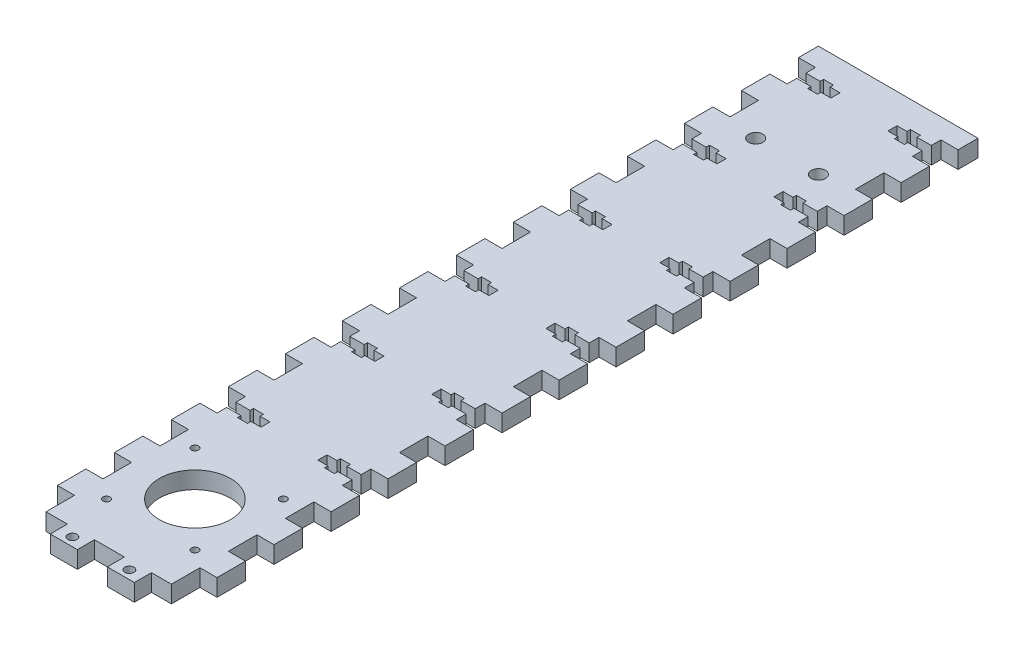
from build123d import *

# Parameters (mm, degrees)
SKETCH1_W               = 56
SKETCH1_H               = 6
BOSS_EXTRUDE1_DEPTH     = 277
SKETCH3_W               = 6
SKETCH3_H               = 10
CUT_EXTRUDE1_DEPTH      = 291.029245391
SKETCH6_W               = 9.5
SKETCH6_H               = 6
BOSS_EXTRUDE2_DEPTH     = 6
SKETCH9_W               = 3.2
SKETCH9_H               = 6
CUT_EXTRUDE2_DEPTH      = 12
SKETCH10_W              = 3.2
SKETCH10_H              = 6
CUT_EXTRUDE3_DEPTH      = 12
SKETCH11_W              = 3.5
SKETCH11_H              = 5.6
CUT_EXTRUDE4_DEPTH      = 12
SKETCH12_R              = 1.6
CUT_EXTRUDE5_DEPTH      = 12
SKETCH17_W              = 44
SKETCH17_H              = 10
BOSS_EXTRUDE5_DEPTH     = 6
CUT_EXTRUDE6_DEPTH      = 296.765047262
CUT_EXTRUDE6_DEPTH_BACK = 296.765047262
SKETCH14_R              = 1.25
SKETCH14_R_2            = 12.5
SKETCH15_R              = 2.5
CUT_EXTRUDE7_DEPTH      = 296.765047262


with BuildPart() as part:
    # Sketch1 → Boss-Extrude1 (new body)
    with BuildSketch(Plane.XY):
        with Locations((-57.743589744, 27.128205128)):
            Rectangle(SKETCH1_W, SKETCH1_H)
    extrude(amount=BOSS_EXTRUDE1_DEPTH)

    # Sketch3 → Cut-Extrude1 (cut, through all)
    with BuildSketch(Plane(origin=(0, 30.128205128, 0), x_dir=(1, 0, 0), z_dir=(0, 1, 0))):
        with Locations((-82.743589744, -272)):
            Rectangle(SKETCH3_W, SKETCH3_H)
        with Locations((-32.743589744, -272)):
            Rectangle(SKETCH3_W, SKETCH3_H)
        with Locations((-82.743589744, -252)):
            Rectangle(SKETCH3_W, SKETCH3_H)
        with Locations((-32.743589744, -252)):
            Rectangle(SKETCH3_W, SKETCH3_H)
        with Locations((-82.743589744, -232)):
            Rectangle(SKETCH3_W, SKETCH3_H)
        with Locations((-32.743589744, -232)):
            Rectangle(SKETCH3_W, SKETCH3_H)
        with Locations((-82.743589744, -212)):
            Rectangle(SKETCH3_W, SKETCH3_H)
        with Locations((-32.743589744, -212)):
            Rectangle(SKETCH3_W, SKETCH3_H)
        with Locations((-82.743589744, -192)):
            Rectangle(SKETCH3_W, SKETCH3_H)
        with Locations((-32.743589744, -192)):
            Rectangle(SKETCH3_W, SKETCH3_H)
        with Locations((-82.743589744, -172)):
            Rectangle(SKETCH3_W, SKETCH3_H)
        with Locations((-32.743589744, -172)):
            Rectangle(SKETCH3_W, SKETCH3_H)
        with Locations((-82.743589744, -152)):
            Rectangle(SKETCH3_W, SKETCH3_H)
        with Locations((-32.743589744, -152)):
            Rectangle(SKETCH3_W, SKETCH3_H)
        with Locations((-82.743589744, -132)):
            Rectangle(SKETCH3_W, SKETCH3_H)
        with Locations((-32.743589744, -132)):
            Rectangle(SKETCH3_W, SKETCH3_H)
        with Locations((-82.743589744, -112)):
            Rectangle(SKETCH3_W, SKETCH3_H)
        with Locations((-32.743589744, -112)):
            Rectangle(SKETCH3_W, SKETCH3_H)
        with Locations((-82.743589744, -92)):
            Rectangle(SKETCH3_W, SKETCH3_H)
        with Locations((-32.743589744, -92)):
            Rectangle(SKETCH3_W, SKETCH3_H)
        with Locations((-82.743589744, -72)):
            Rectangle(SKETCH3_W, SKETCH3_H)
        with Locations((-32.743589744, -72)):
            Rectangle(SKETCH3_W, SKETCH3_H)
        with Locations((-82.743589744, -52)):
            Rectangle(SKETCH3_W, SKETCH3_H)
        with Locations((-32.743589744, -52)):
            Rectangle(SKETCH3_W, SKETCH3_H)
        with Locations((-82.743589744, -32)):
            Rectangle(SKETCH3_W, SKETCH3_H)
        with Locations((-32.743589744, -32)):
            Rectangle(SKETCH3_W, SKETCH3_H)
        with Locations((-82.743589744, -12)):
            Rectangle(SKETCH3_W, SKETCH3_H)
        with Locations((-32.743589744, -12)):
            Rectangle(SKETCH3_W, SKETCH3_H)
    extrude(amount=-CUT_EXTRUDE1_DEPTH, mode=Mode.SUBTRACT)

    # Sketch6 → Boss-Extrude2 (add)
    with BuildSketch(Plane.XY.offset(277)):
        with Locations((-67.493589744, 27.128205128)):
            Rectangle(SKETCH6_W, SKETCH6_H)
        with Locations((-47.493589744, 27.128205128)):
            Rectangle(SKETCH6_W, SKETCH6_H)
    extrude(amount=BOSS_EXTRUDE2_DEPTH)

    # Sketch9 → Cut-Extrude2 (cut)
    with BuildSketch(Plane(origin=(-35.743589744, 0, 0), x_dir=(0, 0, -1), z_dir=(1, 0, 0))):
        with Locations((-252, 27.128205128)):
            Rectangle(SKETCH9_W, SKETCH9_H)
        with Locations((-212, 27.128205128)):
            Rectangle(SKETCH9_W, SKETCH9_H)
        with Locations((-172, 27.128205128)):
            Rectangle(SKETCH9_W, SKETCH9_H)
        with Locations((-132, 27.128205128)):
            Rectangle(SKETCH9_W, SKETCH9_H)
        with Locations((-92, 27.128205128)):
            Rectangle(SKETCH9_W, SKETCH9_H)
        with Locations((-52, 27.128205128)):
            Rectangle(SKETCH9_W, SKETCH9_H)
        with Locations((-12, 27.128205128)):
            Rectangle(SKETCH9_W, SKETCH9_H)
    extrude(amount=-CUT_EXTRUDE2_DEPTH, mode=Mode.SUBTRACT)

    # Sketch10 → Cut-Extrude3 (cut)
    with BuildSketch(Plane.ZY.offset(79.743589744)):
        with Locations((252, 27.128205128)):
            Rectangle(SKETCH10_W, SKETCH10_H)
        with Locations((212, 27.128205128)):
            Rectangle(SKETCH10_W, SKETCH10_H)
        with Locations((172, 27.128205128)):
            Rectangle(SKETCH10_W, SKETCH10_H)
        with Locations((132, 27.128205128)):
            Rectangle(SKETCH10_W, SKETCH10_H)
        with Locations((92, 27.128205128)):
            Rectangle(SKETCH10_W, SKETCH10_H)
        with Locations((52, 27.128205128)):
            Rectangle(SKETCH10_W, SKETCH10_H)
        with Locations((12, 27.128205128)):
            Rectangle(SKETCH10_W, SKETCH10_H)
    extrude(amount=-CUT_EXTRUDE3_DEPTH, mode=Mode.SUBTRACT)

    # Sketch11 → Cut-Extrude4 (cut)
    with BuildSketch(Plane.XZ.offset(-24.128205128)):
        with Locations((-72.993589744, 252)):
            Rectangle(SKETCH11_W, SKETCH11_H)
        with Locations((-42.493589744, 252)):
            Rectangle(SKETCH11_W, SKETCH11_H)
        with Locations((-72.993589744, 212)):
            Rectangle(SKETCH11_W, SKETCH11_H)
        with Locations((-42.493589744, 212)):
            Rectangle(SKETCH11_W, SKETCH11_H)
        with Locations((-72.993589744, 172)):
            Rectangle(SKETCH11_W, SKETCH11_H)
        with Locations((-42.493589744, 172)):
            Rectangle(SKETCH11_W, SKETCH11_H)
        with Locations((-72.993589744, 132)):
            Rectangle(SKETCH11_W, SKETCH11_H)
        with Locations((-42.493589744, 132)):
            Rectangle(SKETCH11_W, SKETCH11_H)
        with Locations((-72.993589744, 92)):
            Rectangle(SKETCH11_W, SKETCH11_H)
        with Locations((-42.493589744, 92)):
            Rectangle(SKETCH11_W, SKETCH11_H)
        with Locations((-72.993589744, 52)):
            Rectangle(SKETCH11_W, SKETCH11_H)
        with Locations((-42.493589744, 52)):
            Rectangle(SKETCH11_W, SKETCH11_H)
        with Locations((-72.993589744, 12)):
            Rectangle(SKETCH11_W, SKETCH11_H)
        with Locations((-42.493589744, 12)):
            Rectangle(SKETCH11_W, SKETCH11_H)
    extrude(amount=-CUT_EXTRUDE4_DEPTH, mode=Mode.SUBTRACT)

    # Sketch12 → Cut-Extrude5 (cut)
    with BuildSketch(Plane.XZ.offset(-24.128205128)):
        with Locations(Location((-67.493589744, 280, 0), (0, 0, 270))):
            Circle(SKETCH12_R)
        with Locations(Location((-47.493589744, 280, 0), (0, 0, 270))):
            Circle(SKETCH12_R)
    extrude(amount=-CUT_EXTRUDE5_DEPTH, mode=Mode.SUBTRACT)

    # Sketch17 → Boss-Extrude5 (add, through all)
    with BuildSketch(Plane(origin=(0, 30.128205128, 0), x_dir=(1, 0, 0), z_dir=(0, 1, 0))):
        with Locations((-57.743589744, -252)):
            Rectangle(SKETCH17_W, SKETCH17_H)
    extrude(amount=-BOSS_EXTRUDE5_DEPTH)

    # Sketch14 → Cut-Extrude6 (cut, two sides: drawn at the far end of the back side and taken through both)
    with BuildSketch(Plane.XZ.offset(-24.128205128).offset(-CUT_EXTRUDE6_DEPTH_BACK)):
        with Locations(Location((-72.993589744, 262.5, 0), (0, 0, 270))):
            Circle(SKETCH14_R)
        with Locations(Location((-41.993589744, 262.5, 0), (0, 0, 270))):
            Circle(SKETCH14_R)
        with Locations(Location((-41.993589744, 231.5, 0), (0, 0, 270))):
            Circle(SKETCH14_R)
        with Locations(Location((-72.993589744, 231.5, 0), (0, 0, 270))):
            Circle(SKETCH14_R)
        with Locations(Location((-57.493589744, 247, 0), (0, 0, 270))):
            Circle(SKETCH14_R_2)
    extrude(amount=CUT_EXTRUDE6_DEPTH + CUT_EXTRUDE6_DEPTH_BACK, mode=Mode.SUBTRACT)

    # Sketch15 → Cut-Extrude7 (cut, through all)
    with BuildSketch(Plane.XZ.offset(-24.128205128)):
        with Locations(Location((-68.743589744, 39, 0), (0, 0, 270))):
            Circle(SKETCH15_R)
        with Locations(Location((-46.743589744, 39, 0), (0, 0, 90))):
            Circle(SKETCH15_R)
    extrude(amount=-CUT_EXTRUDE7_DEPTH, mode=Mode.SUBTRACT)


solid = part.part
